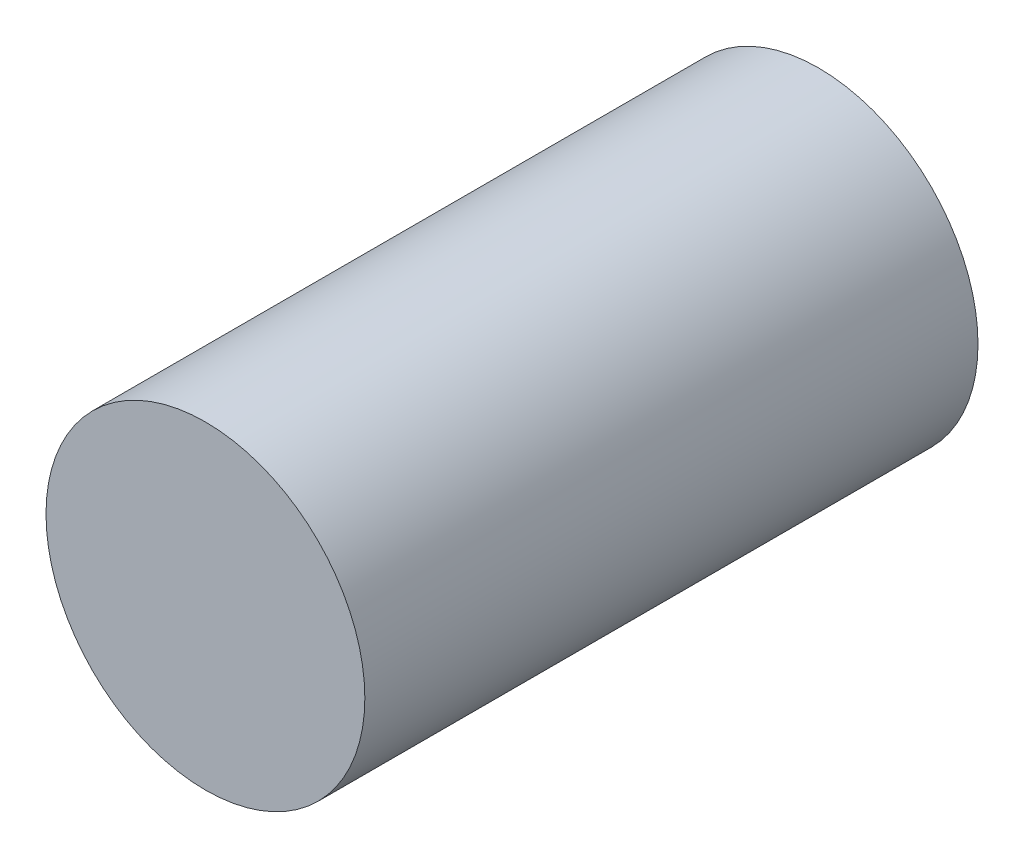
from build123d import *

# Parameters (mm, degrees)
SKETCH1_R           = 13
BOSS_EXTRUDE1_DEPTH = 50


with BuildPart() as part:
    # Sketch1 → Boss-Extrude1 (new body)
    with BuildSketch(Plane.XY):
        Circle(SKETCH1_R)
    extrude(amount=BOSS_EXTRUDE1_DEPTH)


solid = part.part
